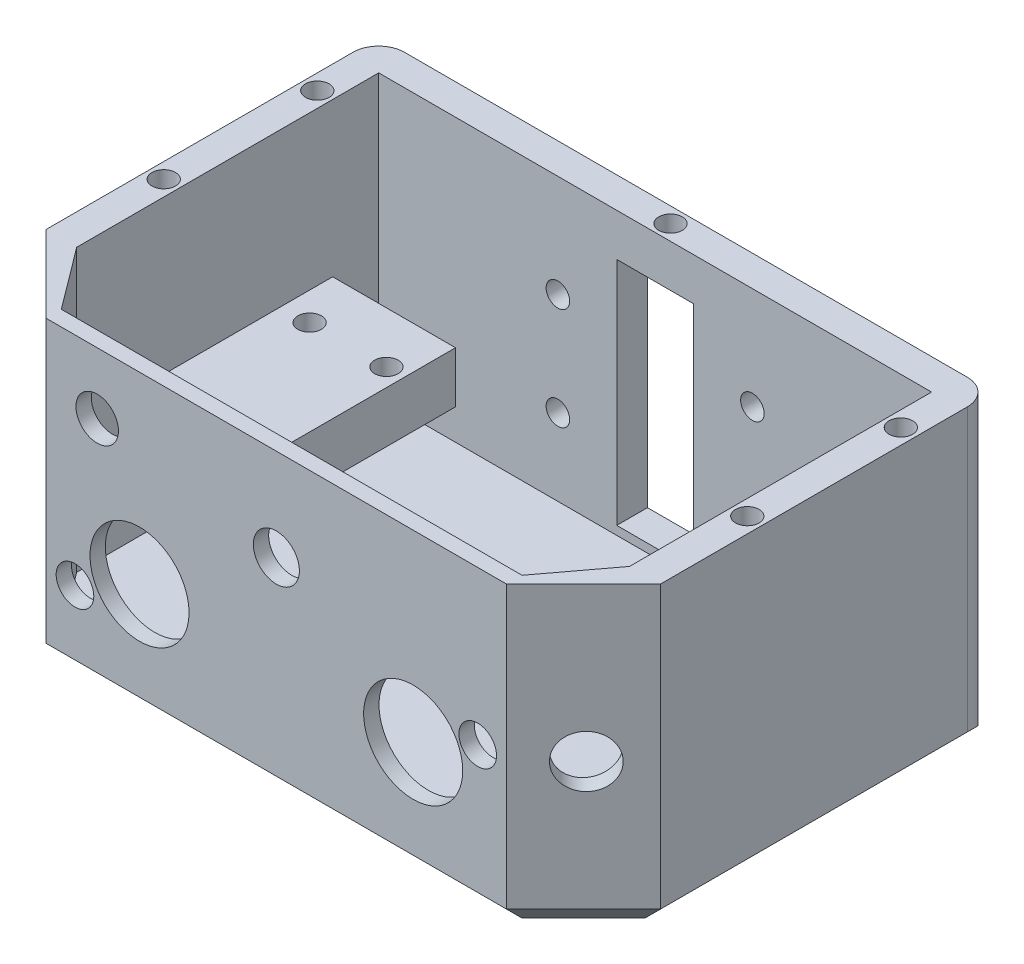
from build123d import *

# Parameters (mm, degrees)
ESQUISSE1_W              = 120
ESQUISSE1_H              = 60
BOSS_EXTRU_1_DEPTH       = 80
CHANFREIN1_SIZE          = 15
CHANFREIN2_SIZE          = 15
ENL_V_MAT_EXTRU_1_DEPTH  = 55
ESQUISSE3_R              = 4.5
ESQUISSE3_R_2            = 4.15
ESQUISSE3_R_3            = 9.675
ESQUISSE3_R_4            = 3.675
ENL_V_MAT_EXTRU_2_DEPTH  = 10
ESQUISSE4_R              = 5.1
ENL_V_MAT_EXTRU_3_DEPTH  = 10
ESQUISSE5_R              = 5.1
ENL_V_MAT_EXTRU_4_DEPTH  = 10
CHANFREIN3_SIZE          = 5
ESQUISSE7_W              = 15
ESQUISSE7_H              = 45
ENL_V_MAT_EXTRU_5_DEPTH  = 15
CHANFREIN5_SIZE          = 5
ESQUISSE8_W              = 25
ESQUISSE8_H              = 2
BOSS_EXTRU_2_DEPTH       = 6
ESQUISSE10_W             = 40
ESQUISSE10_H             = 10
BOSS_EXTRU_4_DEPTH       = 30
ESQUISSE11_W             = 40
ESQUISSE11_H             = 10
BOSS_EXTRU_5_DEPTH       = 30
ESQUISSE12_R             = 2.3
ENL_V_MAT_EXTRU_7_DEPTH  = 15
ESQUISSE13_R             = 2.3
ENL_V_MAT_EXTRU_8_DEPTH  = 16
ESQUISSE14_R             = 2.3
ENL_V_MAT_EXTRU_9_DEPTH  = 10
ESQUISSE15_R             = 3.2
ESQUISSE15_R_2           = 3.25
BOSS_EXTRU_6_DEPTH       = 3.4
ESQUISSE16_R             = 2.3
ENL_V_MAT_EXTRU_10_DEPTH = 5
ESQUISSE18_W             = 15
ESQUISSE18_H             = 12
ENL_V_MAT_EXTRU_13_DEPTH = 9
CONG_1_R                 = 5


with BuildPart() as part:
    # Esquisse1 → Boss.-Extru.1 (new body)
    with BuildSketch(Plane.XY):
        Rectangle(ESQUISSE1_W, ESQUISSE1_H)
    extrude(amount=-BOSS_EXTRU_1_DEPTH)

    # Chanfrein1
    chanfrein1_edges = [part.edges().sort_by_distance(p)[0] for p in [
        (60, 0, 0),
    ]]
    chamfer(chanfrein1_edges, length=CHANFREIN1_SIZE)

    # Chanfrein2
    chanfrein2_edges = [part.edges().sort_by_distance(p)[0] for p in [
        (-60, 0, 0),
    ]]
    chamfer(chanfrein2_edges, length=CHANFREIN2_SIZE)

    # Esquisse2 → Enlèv. mat.-Extru.1 (cut)
    with BuildSketch(Plane(origin=(0, 30, 0), x_dir=(1, 0, 0), z_dir=(0, 1, 0))):
        Polygon((-54, 15), (-54, 74), (54, 74), (54, 15), (45, 3), (-45, 3), align=None)
    extrude(amount=-ENL_V_MAT_EXTRU_1_DEPTH, mode=Mode.SUBTRACT)

    # Esquisse3 → Enlèv. mat.-Extru.2 (cut)
    with BuildSketch(Plane.XY):
        with Locations((0, 12)):
            Circle(ESQUISSE3_R)
        with Locations((-35, 18)):
            Circle(ESQUISSE3_R_2)
        with Locations((26.73, -5.87)):
            Circle(ESQUISSE3_R_3)
        with Locations((-26.73, -5.87)):
            Circle(ESQUISSE3_R_3)
        with Locations((39.34, 0)):
            Circle(ESQUISSE3_R_4)
        with Locations((-39.34, -12.37)):
            Circle(ESQUISSE3_R_4)
    extrude(amount=-ENL_V_MAT_EXTRU_2_DEPTH, mode=Mode.SUBTRACT)

    # Esquisse4 → Enlèv. mat.-Extru.3 (cut)
    with BuildSketch(Plane(origin=(22.5, 0, 22.5), x_dir=(0.7071067811865464, 0, -0.7071067811865488), z_dir=(0.7071067811865488, 0, 0.7071067811865464))):
        with Locations((42.819805153, 0)):
            Circle(ESQUISSE4_R)
    extrude(amount=-ENL_V_MAT_EXTRU_3_DEPTH, mode=Mode.SUBTRACT)

    # Esquisse5 → Enlèv. mat.-Extru.4 (cut)
    with BuildSketch(Plane(origin=(-22.5, 0, 22.5), x_dir=(0.7071067811865464, 0, 0.7071067811865488), z_dir=(-0.7071067811865488, 0, 0.7071067811865464))):
        with Locations((-42.819805153, 0)):
            Circle(ESQUISSE5_R)
    extrude(amount=-ENL_V_MAT_EXTRU_4_DEPTH, mode=Mode.SUBTRACT)

    # Chanfrein3
    chanfrein3_edges = [part.edges().sort_by_distance(p)[0] for p in [
        (52.5, -30, -7.5),
        (0, -30, 0),
        (-52.5, -30, -7.5),
        (60, -30, -47.5),
        (-60, -30, -47.5),
    ]]
    chamfer(chanfrein3_edges, length=CHANFREIN3_SIZE)

    # Esquisse7 → Enlèv. mat.-Extru.5 (cut)
    with BuildSketch(Plane(origin=(0, 0, -80), x_dir=(-1, 0, 0), z_dir=(0, 0, -1))):
        with Locations((0, -0.81)):
            Rectangle(ESQUISSE7_W, ESQUISSE7_H)
    extrude(amount=-ENL_V_MAT_EXTRU_5_DEPTH, mode=Mode.SUBTRACT)

    # Chanfrein5
    chanfrein5_edges = [part.edges().sort_by_distance(p)[0] for p in [
        (0, -30, -80),
    ]]
    chamfer(chanfrein5_edges, length=CHANFREIN5_SIZE)

    # Esquisse8 → Boss.-Extru.2 (add)
    with BuildSketch(Plane.XY):
        with Locations((0, 24)):
            Rectangle(ESQUISSE8_W, ESQUISSE8_H)
    extrude(amount=-BOSS_EXTRU_2_DEPTH)

    # Esquisse10 → Boss.-Extru.4 (add)
    with BuildSketch(Plane(origin=(60, 0, 0), x_dir=(0, 0, -1), z_dir=(1, 0, 0))):
        with Locations((45, -5)):
            Rectangle(ESQUISSE10_W, ESQUISSE10_H)
    extrude(amount=-BOSS_EXTRU_4_DEPTH)

    # Esquisse11 → Boss.-Extru.5 (add)
    with BuildSketch(Plane.ZY.offset(60)):
        with Locations((-45, -5)):
            Rectangle(ESQUISSE11_W, ESQUISSE11_H)
    extrude(amount=-BOSS_EXTRU_5_DEPTH)

    # Esquisse12 → Enlèv. mat.-Extru.7 (cut)
    with BuildSketch(Plane(origin=(0, 0, 0), x_dir=(1, 0, 0), z_dir=(0, 1, 0))):
        with Locations(Location((33.5, 55, 0), (0, 0, 270))):
            Circle(ESQUISSE12_R)
        with Locations(Location((48.5, 55, 0), (0, 0, 270))):
            Circle(ESQUISSE12_R)
        with Locations(Location((-33.5, 55, 0), (0, 0, 270))):
            Circle(ESQUISSE12_R)
        with Locations(Location((-48.5, 55, 0), (0, 0, 270))):
            Circle(ESQUISSE12_R)
    extrude(amount=-ENL_V_MAT_EXTRU_7_DEPTH, mode=Mode.SUBTRACT)

    # Esquisse13 → Enlèv. mat.-Extru.8 (cut)
    with BuildSketch(Plane(origin=(0, 30, 0), x_dir=(1, 0, 0), z_dir=(0, 1, 0))):
        with Locations(Location((-57, 65, 0), (0, 0, 270))):
            Circle(ESQUISSE13_R)
        with Locations(Location((-57, 35, 0), (0, 0, 270))):
            Circle(ESQUISSE13_R)
        with Locations(Location((57, 65, 0), (0, 0, 270))):
            Circle(ESQUISSE13_R)
        with Locations(Location((57, 35, 0), (0, 0, 270))):
            Circle(ESQUISSE13_R)
        with Locations(Location((0, 77, 0), (0, 0, 270))):
            Circle(ESQUISSE13_R)
    extrude(amount=-ENL_V_MAT_EXTRU_8_DEPTH, mode=Mode.SUBTRACT)

    # Esquisse14 → Enlèv. mat.-Extru.9 (cut)
    with BuildSketch(Plane(origin=(0, 0, -80), x_dir=(-1, 0, 0), z_dir=(0, 0, -1))):
        with Locations((19, 10)):
            Circle(ESQUISSE14_R)
        with Locations((19, -10)):
            Circle(ESQUISSE14_R)
        with Locations((-19, -10)):
            Circle(ESQUISSE14_R)
        with Locations((-19, 10)):
            Circle(ESQUISSE14_R)
    extrude(amount=-ENL_V_MAT_EXTRU_9_DEPTH, mode=Mode.SUBTRACT)

    # Esquisse15 → Boss.-Extru.6 (add)
    with BuildSketch(Plane(origin=(0, 0, -3), x_dir=(-1, 0, 0), z_dir=(0, 0, -1))):
        with Locations(Location((17, 11, 0), (0, 0, 180))):
            Circle(ESQUISSE15_R)
        with Locations(Location((-17, 11, 0), (0, 0, 180))):
            Circle(ESQUISSE15_R_2)
    extrude(amount=BOSS_EXTRU_6_DEPTH)

    # Esquisse16 → Enlèv. mat.-Extru.10 (cut)
    with BuildSketch(Plane(origin=(0, 0, -6.4), x_dir=(-1, 0, 0), z_dir=(0, 0, -1))):
        with Locations((17, 11)):
            Circle(ESQUISSE16_R)
        with Locations((-17, 11)):
            Circle(ESQUISSE16_R)
    extrude(amount=-ENL_V_MAT_EXTRU_10_DEPTH, mode=Mode.SUBTRACT)

    # Esquisse18 → Enlèv. mat.-Extru.13 (cut)
    with BuildSketch(Plane(origin=(0, -25, 0), x_dir=(1, 0, 0), z_dir=(0, 1, 0))):
        with Locations((0, 9)):
            Rectangle(ESQUISSE18_W, ESQUISSE18_H)
        with Locations((0, 36)):
            Rectangle(ESQUISSE18_W, ESQUISSE18_H)
    extrude(amount=-ENL_V_MAT_EXTRU_13_DEPTH, mode=Mode.SUBTRACT)

    # Congé1
    cong_1_edges = [part.edges().sort_by_distance(p)[0] for p in [
        (-60, 2.5, -80),
        (60, 2.5, -80),
    ]]
    fillet(cong_1_edges, radius=CONG_1_R)


solid = part.part
